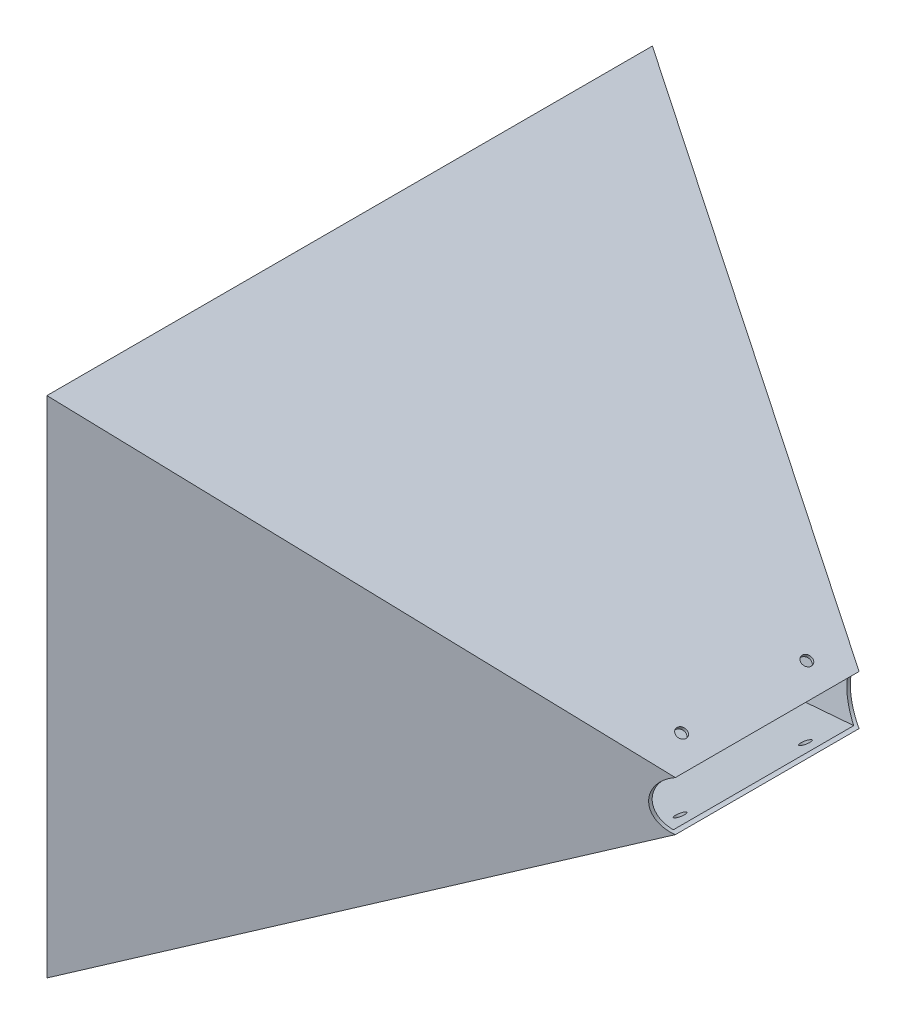
from build123d import *

# Parameters (mm, degrees)
BOSS_EXTRUDE1_DEPTH     = 290
CUT_EXTRUDE1_DEPTH      = 290
CUT_EXTRUDE1_DEPTH_BACK = 290
SHELL3_T                = -1.5
SKETCH3_R               = 2.5
CUT_EXTRUDE2_DEPTH      = 20
SKETCH4_R               = 2.5
CUT_EXTRUDE3_DEPTH      = 18
CUT_EXTRUDE4_DEPTH      = 119
CUT_EXTRUDE4_DEPTH_BACK = 128


with BuildPart() as part:
    # Sketch1 → Boss-Extrude1 (new body)
    with BuildSketch(Plane.XY):
        with BuildLine():
            Line((-4, -11.842719282), (-204, -120.795710387))
            Line((-204, -120.795710387), (-204, 120.795710387))
            Line((-204, 120.795710387), (-4, 11.842719282))
            Line((-4, 11.842719282), (-4, 8.61684397))
            ThreePointArc((-4, 8.61684397), (-9.5, 0), (-4, -8.61684397))
            Line((-4, -8.61684397), (-4, -11.842719282))
        make_face()
    extrude(amount=BOSS_EXTRUDE1_DEPTH)

    # Sketch2 → Cut-Extrude1 (cut, two sides: drawn at the far end of the back side and taken through both)
    with BuildSketch(Plane(origin=(0, 0, 0), x_dir=(-1, 0, 0), z_dir=(0, -1, 0)).offset(-CUT_EXTRUDE1_DEPTH_BACK)):
        Polygon((4, -189), (204, -290), (4, -290), align=None)
        Polygon((4, -101), (204, 0), (4, 0), align=None)
    extrude(amount=CUT_EXTRUDE1_DEPTH + CUT_EXTRUDE1_DEPTH_BACK, mode=Mode.SUBTRACT)

    # Shell3
    shell3_openings = [part.faces().sort_by_distance(p)[0] for p in [
        (-9.5, 0, 145),
        (-204, 0, 145),
    ]]
    offset(amount=SHELL3_T, openings=shell3_openings, kind=Kind.INTERSECTION)

    # Sketch3 → Cut-Extrude2 (cut)
    with BuildSketch(Plane(origin=(4.059646396, -7.452106372, 0), x_dir=(-0.8781500169152763, -0.47838535490930323, 0), z_dir=(0.4783853549093033, -0.8781500169152764, 0))):
        with Locations((21.727983535, -175)):
            Circle(SKETCH3_R)
        with Locations((21.727983535, -115)):
            Circle(SKETCH3_R)
    extrude(amount=-CUT_EXTRUDE2_DEPTH, mode=Mode.SUBTRACT)

    # Sketch4 → Cut-Extrude3 (cut)
    with BuildSketch(Plane(origin=(4.059646396, 7.452106372, 0), x_dir=(0.8781500169152766, -0.47838535490930256, 0), z_dir=(0.47838535490930256, 0.8781500169152766, 0))):
        with Locations((-21.727983535, -115)):
            Circle(SKETCH4_R)
        with Locations((-21.727983535, -175)):
            Circle(SKETCH4_R)
    extrude(amount=-CUT_EXTRUDE3_DEPTH, mode=Mode.SUBTRACT)

    # Sketch6 → Cut-Extrude4 (cut, two sides: drawn at the far end of the back side and taken through both)
    with BuildSketch(Plane.XY.offset(145).offset(-CUT_EXTRUDE4_DEPTH_BACK)):
        with BuildLine():
            Line((-4, 11.842719282), (-4, -11.842719282))
            ThreePointArc((-4, -11.842719282), (-12.5, 0), (-4, 11.842719282))
        make_face()
    extrude(amount=CUT_EXTRUDE4_DEPTH + CUT_EXTRUDE4_DEPTH_BACK, mode=Mode.SUBTRACT)


solid = part.part
